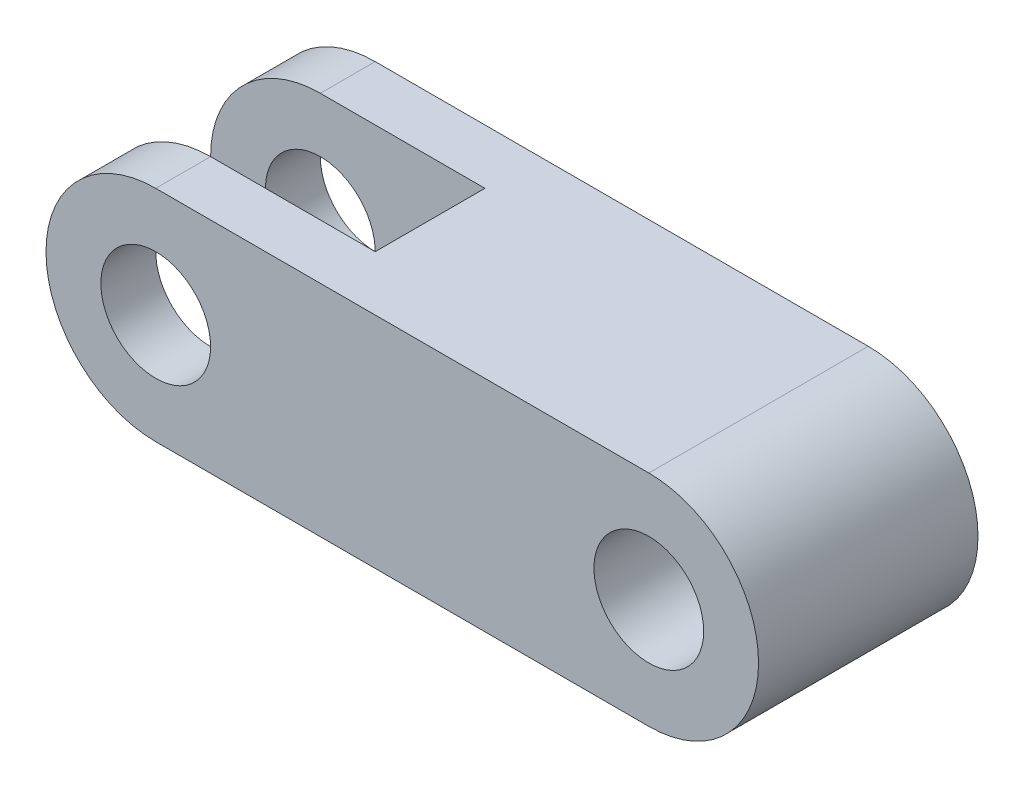
from build123d import *

# Parameters (mm, degrees)
SKETCH1_R           = 5
BOSS_EXTRUDE1_DEPTH = 20
SKETCH2_W           = 25
SKETCH2_H           = 10
CUT_EXTRUDE1_DEPTH  = 62.789458799


with BuildPart() as part:
    # Sketch1 → Boss-Extrude1 (new body)
    with BuildSketch(Plane.XY):
        with BuildLine():
            Line((0, 10), (44.935755376, 10))
            ThreePointArc((44.935755376, 10), (54.935755376, 0), (44.935755376, -10))
            Line((44.935755376, -10), (0, -10))
            ThreePointArc((0, -10), (-10, 0), (0, 10))
        make_face()
        Circle(SKETCH1_R, mode=Mode.SUBTRACT)
        with Locations((44.935755376, 0)):
            Circle(SKETCH1_R, mode=Mode.SUBTRACT)
    extrude(amount=BOSS_EXTRUDE1_DEPTH)

    # Sketch2 → Cut-Extrude1 (cut, through all)
    with BuildSketch(Plane(origin=(0, 10, 0), x_dir=(1, 0, 0), z_dir=(0, 1, 0))):
        with Locations((2.5, -10)):
            Rectangle(SKETCH2_W, SKETCH2_H)
    extrude(amount=-CUT_EXTRUDE1_DEPTH, mode=Mode.SUBTRACT)


solid = part.part
